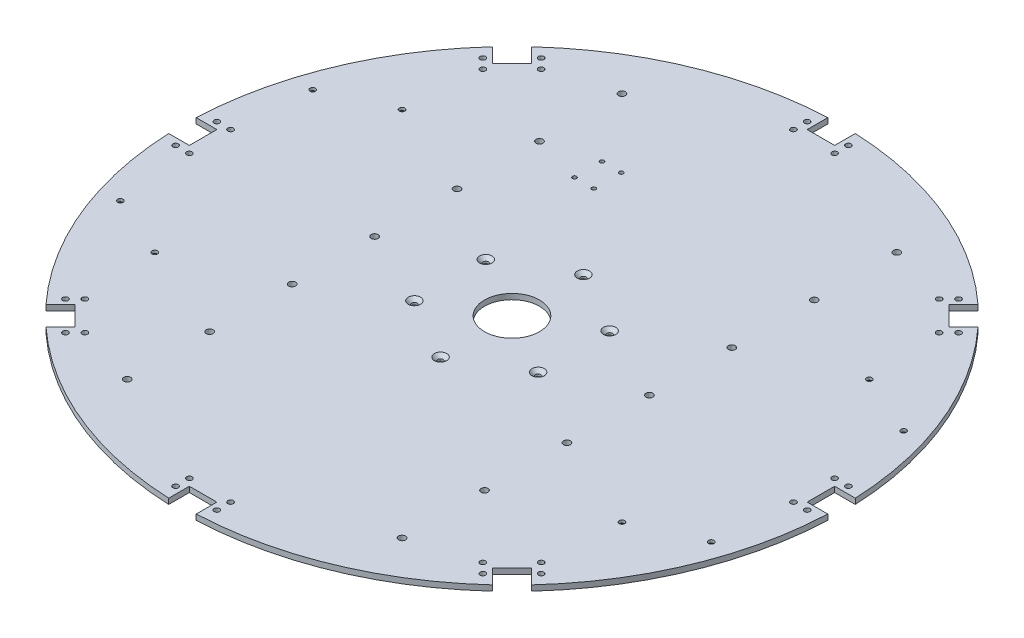
from build123d import *

# Parameters (mm, degrees)
SKETCH_1_R          = 240
EXTRUDE_1_DEPTH     = 4
SKETCH_2_R          = 2
SKETCH_2_R_2        = 1.5
SKETCH_2_R_3        = 2.5
SKETCH_2_R_4        = 20
CUT_EXTRUDE_2_DEPTH = 340.434824377
CHAMFER_1_SIZE      = 2.5
SKETCH_3_R          = 2
CUT_EXTRUDE_3_DEPTH = 340.434824377
CHAMFER_2_SIZE      = 2


with BuildPart() as part:
    # 草图1 → 凸台-拉伸1 (new body)
    with BuildSketch(Plane(origin=(0, 0, 0), x_dir=(1, 0, 0), z_dir=(0, 1, 0))):
        with Locations(Location((0, 0, 0), (0, 0, 270))):
            Circle(SKETCH_1_R)
    extrude(amount=EXTRUDE_1_DEPTH)

    # 草图2 → 切除-拉伸2 (cut, through all)
    with BuildSketch(Plane(origin=(0, 0, 0), x_dir=(1, 0, 0), z_dir=(0, 1, 0))):
        with Locations(Location((-45.033320997, 26, 0), (0, 0, 270))):
            Circle(SKETCH_2_R)
        with Locations(Location((0, 52, 0), (0, 0, 270))):
            Circle(SKETCH_2_R)
        with Locations(Location((45.033320997, 26, 0), (0, 0, 270))):
            Circle(SKETCH_2_R)
        with Locations(Location((45.033320997, -26, 0), (0, 0, 270))):
            Circle(SKETCH_2_R)
        with Locations(Location((0, -52, 0), (0, 0, 270))):
            Circle(SKETCH_2_R)
        with Locations(Location((-45.033320997, -26, 0), (0, 0, 270))):
            Circle(SKETCH_2_R)
        with Locations(Location((-64.5, 130, 0), (0, 0, 270))):
            Circle(SKETCH_2_R_2)
        with Locations(Location((100, 0, 0), (0, 0, 270))):
            Circle(SKETCH_2_R_3)
        with Locations(Location((100, 60, 0), (0, 0, 270))):
            Circle(SKETCH_2_R_3)
        with Locations(Location((100, 120, 0), (0, 0, 270))):
            Circle(SKETCH_2_R_3)
        with Locations(Location((100, 180, 0), (0, 0, 270))):
            Circle(SKETCH_2_R_3)
        with Locations(Location((100, -60, 0), (0, 0, 270))):
            Circle(SKETCH_2_R_3)
        with Locations(Location((100, -120, 0), (0, 0, 270))):
            Circle(SKETCH_2_R_3)
        with Locations(Location((100, -180, 0), (0, 0, 270))):
            Circle(SKETCH_2_R_3)
        with Locations(Location((-100, -180, 0), (0, 0, 90))):
            Circle(SKETCH_2_R_3)
        with Locations(Location((-100, -120, 0), (0, 0, 90))):
            Circle(SKETCH_2_R_3)
        with Locations(Location((-100, -60, 0), (0, 0, 90))):
            Circle(SKETCH_2_R_3)
        with Locations(Location((-100, 180, 0), (0, 0, 90))):
            Circle(SKETCH_2_R_3)
        with Locations(Location((-100, 120, 0), (0, 0, 90))):
            Circle(SKETCH_2_R_3)
        with Locations(Location((-100, 60, 0), (0, 0, 90))):
            Circle(SKETCH_2_R_3)
        with Locations(Location((-100, 0, 0), (0, 0, 90))):
            Circle(SKETCH_2_R_3)
        with Locations(Location((-50.5, 130, 0), (0, 0, 270))):
            Circle(SKETCH_2_R_2)
        with Locations(Location((-64.5, 110, 0), (0, 0, 270))):
            Circle(SKETCH_2_R_2)
        with Locations(Location((-50.5, 110, 0), (0, 0, 270))):
            Circle(SKETCH_2_R_2)
        with Locations(Location((0, 0, 0), (0, 0, 270))):
            Circle(SKETCH_2_R_4)
        with Locations(Location((170, 90, 0), (0, 0, 270))):
            Circle(SKETCH_2_R)
        with Locations(Location((170, -90, 0), (0, 0, 270))):
            Circle(SKETCH_2_R)
        with Locations(Location((-170, -90, 0), (0, 0, 90))):
            Circle(SKETCH_2_R)
        with Locations(Location((-170, 90, 0), (0, 0, 90))):
            Circle(SKETCH_2_R)
        with Locations(Location((215, -70, 0), (0, 0, 270))):
            Circle(SKETCH_2_R)
        with Locations(Location((215, 70, 0), (0, 0, 90))):
            Circle(SKETCH_2_R)
        with Locations(Location((-215, 70, 0), (0, 0, 270))):
            Circle(SKETCH_2_R)
        with Locations(Location((-215, -70, 0), (0, 0, 90))):
            Circle(SKETCH_2_R)
    extrude(amount=CUT_EXTRUDE_2_DEPTH, mode=Mode.SUBTRACT)

    # 倒角1
    chamfer_1_edges = [part.edges().sort_by_distance(p)[0] for p in [
        (-45.033320997, 4, -28),
        (0, 4, -54),
        (45.033320997, 4, -28),
        (45.033320997, 4, 24),
        (0, 4, 50),
        (-45.033320997, 4, 24),
    ]]
    chamfer(chamfer_1_edges, length=CHAMFER_1_SIZE)

    # 草图3 → 切除-拉伸3 (cut, through all)
    with BuildSketch(Plane(origin=(0, 0, 0), x_dir=(1, 0, 0), z_dir=(0, 1, 0))):
        with Locations(Location((151.880580048, 173.093783484, 0), (0, 0, 270))):
            Circle(SKETCH_3_R)
        with Locations(Location((-15, 229.791576166, 0), (0, 0, 270))):
            Circle(SKETCH_3_R)
        with Locations(Location((-15, 219.791576166, 0), (0, 0, 270))):
            Circle(SKETCH_3_R)
        with Locations(Location((15, 219.791576166, 0), (0, 0, 90))):
            Circle(SKETCH_3_R)
        with Locations(Location((15, 229.791576166, 0), (0, 0, 90))):
            Circle(SKETCH_3_R)
        with Locations(Location((144.809512237, 166.022715672, 0), (0, 0, 270))):
            Circle(SKETCH_3_R)
        with Locations(Location((173.093783484, 151.880580048, 0), (0, 0, 90))):
            Circle(SKETCH_3_R)
        with Locations(Location((166.022715672, 144.809512237, 0), (0, 0, 90))):
            Circle(SKETCH_3_R)
        with Locations(Location((229.791576166, 15, 0), (0, 0, 270))):
            Circle(SKETCH_3_R)
        with Locations(Location((219.791576166, 15, 0), (0, 0, 270))):
            Circle(SKETCH_3_R)
        with Locations(Location((229.791576166, -15, 0), (0, 0, 90))):
            Circle(SKETCH_3_R)
        with Locations(Location((219.791576166, -15, 0), (0, 0, 90))):
            Circle(SKETCH_3_R)
        with Locations(Location((173.093783484, -151.880580048, 0), (0, 0, 270))):
            Circle(SKETCH_3_R)
        with Locations(Location((166.022715672, -144.809512237, 0), (0, 0, 270))):
            Circle(SKETCH_3_R)
        with Locations(Location((151.880580048, -173.093783484, 0), (0, 0, 90))):
            Circle(SKETCH_3_R)
        with Locations(Location((144.809512237, -166.022715672, 0), (0, 0, 90))):
            Circle(SKETCH_3_R)
        with Locations(Location((15, -229.791576166, 0), (0, 0, 270))):
            Circle(SKETCH_3_R)
        with Locations(Location((15, -219.791576166, 0), (0, 0, 270))):
            Circle(SKETCH_3_R)
        with Locations(Location((-15, -229.791576166, 0), (0, 0, 90))):
            Circle(SKETCH_3_R)
        with Locations(Location((-15, -219.791576166, 0), (0, 0, 90))):
            Circle(SKETCH_3_R)
        with Locations(Location((-151.880580048, -173.093783484, 0), (0, 0, 270))):
            Circle(SKETCH_3_R)
        with Locations(Location((-144.809512237, -166.022715672, 0), (0, 0, 270))):
            Circle(SKETCH_3_R)
        with Locations(Location((-173.093783484, -151.880580048, 0), (0, 0, 90))):
            Circle(SKETCH_3_R)
        with Locations(Location((-166.022715672, -144.809512237, 0), (0, 0, 90))):
            Circle(SKETCH_3_R)
        with Locations(Location((-229.791576166, -15, 0), (0, 0, 270))):
            Circle(SKETCH_3_R)
        with Locations(Location((-219.791576166, -15, 0), (0, 0, 270))):
            Circle(SKETCH_3_R)
        with Locations(Location((-229.791576166, 15, 0), (0, 0, 90))):
            Circle(SKETCH_3_R)
        with Locations(Location((-219.791576166, 15, 0), (0, 0, 90))):
            Circle(SKETCH_3_R)
        with Locations(Location((-173.093783484, 151.880580048, 0), (0, 0, 270))):
            Circle(SKETCH_3_R)
        with Locations(Location((-166.022715672, 144.809512237, 0), (0, 0, 270))):
            Circle(SKETCH_3_R)
        with Locations(Location((-151.880580048, 173.093783484, 0), (0, 0, 90))):
            Circle(SKETCH_3_R)
        with Locations(Location((-144.809512237, 166.022715672, 0), (0, 0, 90))):
            Circle(SKETCH_3_R)
        with BuildLine():
            Line((-10, 239.791576166), (-10, 224.791576166))
            Line((-10, 224.791576166), (10, 224.791576166))
            Line((10, 224.791576166), (10, 239.791576166))
            ThreePointArc((10, 239.791576166), (0, 240), (-10, 239.791576166))
        make_face()
        with BuildLine():
            Line((166.022715672, 151.880580048), (176.62931739, 162.487181766))
            ThreePointArc((176.62931739, 162.487181766), (169.705627485, 169.705627485), (162.487181766, 176.62931739))
            Line((162.487181766, 176.62931739), (151.880580048, 166.022715672))
            Line((151.880580048, 166.022715672), (166.022715672, 151.880580048))
        make_face()
        with BuildLine():
            Line((224.791576166, -10), (239.791576166, -10))
            ThreePointArc((239.791576166, -10), (240, 0), (239.791576166, 10))
            Line((239.791576166, 10), (224.791576166, 10))
            Line((224.791576166, 10), (224.791576166, -10))
        make_face()
        with BuildLine():
            Line((151.880580048, -166.022715672), (162.487181766, -176.62931739))
            ThreePointArc((162.487181766, -176.62931739), (169.705627485, -169.705627485), (176.62931739, -162.487181766))
            Line((176.62931739, -162.487181766), (166.022715672, -151.880580048))
            Line((166.022715672, -151.880580048), (151.880580048, -166.022715672))
        make_face()
        with BuildLine():
            Line((-10, -224.791576166), (-10, -239.791576166))
            ThreePointArc((-10, -239.791576166), (0, -240), (10, -239.791576166))
            Line((10, -239.791576166), (10, -224.791576166))
            Line((10, -224.791576166), (-10, -224.791576166))
        make_face()
        with BuildLine():
            Line((-166.022715672, -151.880580048), (-176.62931739, -162.487181766))
            ThreePointArc((-176.62931739, -162.487181766), (-169.705627485, -169.705627485), (-162.487181766, -176.62931739))
            Line((-162.487181766, -176.62931739), (-151.880580048, -166.022715672))
            Line((-151.880580048, -166.022715672), (-166.022715672, -151.880580048))
        make_face()
        with BuildLine():
            Line((-224.791576166, 10), (-239.791576166, 10))
            ThreePointArc((-239.791576166, 10), (-240, 0), (-239.791576166, -10))
            Line((-239.791576166, -10), (-224.791576166, -10))
            Line((-224.791576166, -10), (-224.791576166, 10))
        make_face()
        with BuildLine():
            Line((-151.880580048, 166.022715672), (-162.487181766, 176.62931739))
            ThreePointArc((-162.487181766, 176.62931739), (-169.705627485, 169.705627485), (-176.62931739, 162.487181766))
            Line((-176.62931739, 162.487181766), (-166.022715672, 151.880580048))
            Line((-166.022715672, 151.880580048), (-151.880580048, 166.022715672))
        make_face()
    extrude(amount=CUT_EXTRUDE_3_DEPTH, mode=Mode.SUBTRACT)

    # 倒角2
    chamfer_2_edges = [part.edges().sort_by_distance(p)[0] for p in [
        (170, 0, -92),
        (170, 0, 88),
        (-170, 0, 92),
        (-170, 0, -88),
        (215, 0, 68),
        (215, 0, -68),
        (-215, 0, -72),
        (-215, 0, 72),
    ]]
    chamfer(chamfer_2_edges, length=CHAMFER_2_SIZE)


solid = part.part
